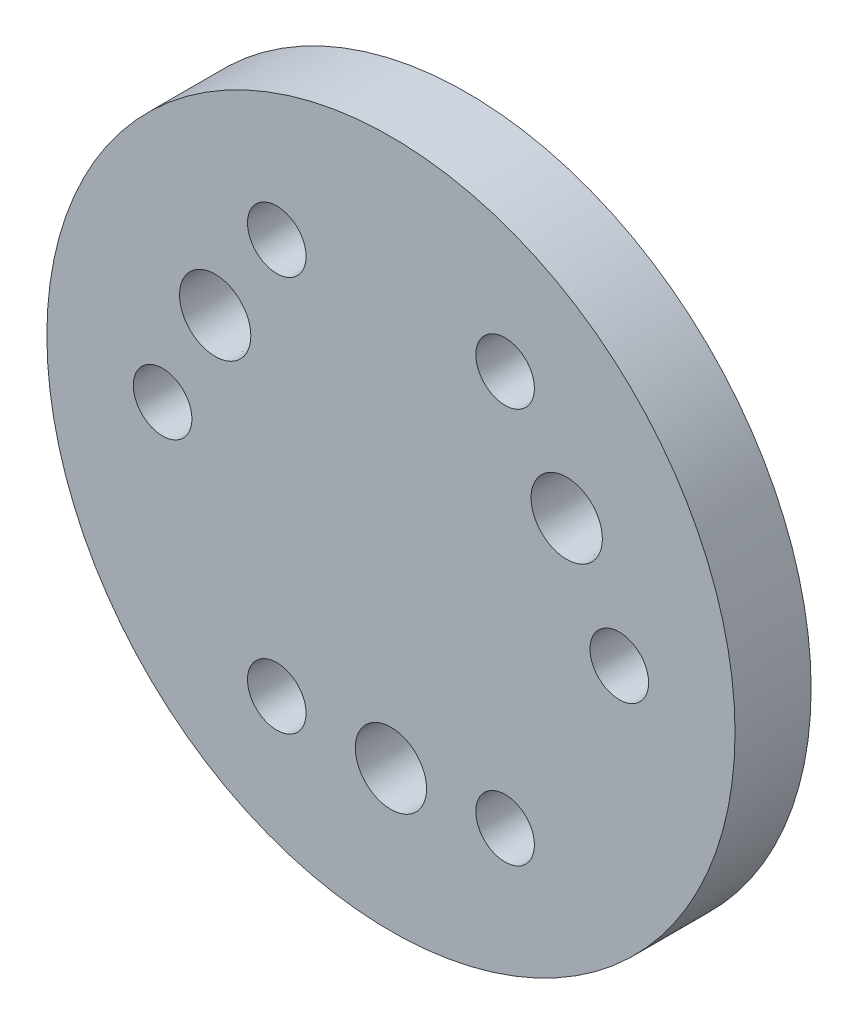
from build123d import *

# Parameters (mm, degrees)
SKETCH1_R                    = 27.125
BOSS_EXTRUDE1_DEPTH          = 6
CUT_EXTRUDE1_START           = 6
SKETCH2_R                    = 2.6
CUT_EXTRUDE1_DEPTH           = 45.826939745
CUT_EXTRUDE1_DRAFT           = 2
CUT_EXTRUDE1_PROFILE_2_DEPTH = 45.826939745
CUT_EXTRUDE1_PROFILE_2_DRAFT = 2
CUT_EXTRUDE1_PROFILE_3_DEPTH = 45.826939745
CUT_EXTRUDE1_PROFILE_3_DRAFT = 2
SKETCH2_R_2                  = 2.1
CUT_EXTRUDE1_PROFILE_4_DEPTH = 45.826939745
CUT_EXTRUDE1_PROFILE_4_DRAFT = 2
CUT_EXTRUDE1_PROFILE_5_DEPTH = 45.826939745
CUT_EXTRUDE1_PROFILE_5_DRAFT = 2
CUT_EXTRUDE1_PROFILE_6_DEPTH = 45.826939745
CUT_EXTRUDE1_PROFILE_6_DRAFT = 2
CUT_EXTRUDE1_PROFILE_7_DEPTH = 45.826939745
CUT_EXTRUDE1_PROFILE_7_DRAFT = 2
CUT_EXTRUDE1_PROFILE_8_DEPTH = 45.826939745
CUT_EXTRUDE1_PROFILE_8_DRAFT = 2
CUT_EXTRUDE1_PROFILE_9_DEPTH = 45.826939745
CUT_EXTRUDE1_PROFILE_9_DRAFT = 2


with BuildPart() as part:
    # Sketch1 → Boss-Extrude1 (new body)
    with BuildSketch(Plane(origin=(0, 0, 0), x_dir=(0, 1, 0), z_dir=(0, 0, 1))):
        with Locations(Location((0, 0, 0), (0, 0, 270))):
            Circle(SKETCH1_R)
    extrude(amount=BOSS_EXTRUDE1_DEPTH)


with BuildPart() as cut_extrude1_tool:
    # Sketch2 → Cut-Extrude1 (with draft: the straight prism first)
    with BuildSketch(Plane(origin=(0, 0, 6), x_dir=(1, 0, 0), z_dir=(0, 0, -1)).offset(CUT_EXTRUDE1_START)):
        with Locations((0, 16)):
            Circle(SKETCH2_R)
    extrude(amount=-CUT_EXTRUDE1_DEPTH)
    # Cut-Extrude1: the draft: its side faces are tilted about the plane it starts from
    cut_extrude1_sides = [cut_extrude1_tool.faces().sort_by_distance(p)[0] for p in [
        (-2.6, -16, 22.913469873),
    ]]
    draft(cut_extrude1_sides, Plane(origin=(0, 0, 6), x_dir=(1, 0, 0), z_dir=(0, 0, -1)).offset(CUT_EXTRUDE1_START), CUT_EXTRUDE1_DRAFT)


with BuildPart() as part_1:
    add(part.part)

    # Cut-Extrude1: cut by cut_extrude1_tool
    add(cut_extrude1_tool.part, mode=Mode.SUBTRACT)


with BuildPart() as cut_extrude1_profile_2_tool:
    # Sketch2 → Cut-Extrude1 profile 2 (with draft: the straight prism first)
    with BuildSketch(Plane(origin=(0, 0, 6), x_dir=(1, 0, 0), z_dir=(0, 0, -1)).offset(CUT_EXTRUDE1_START)):
        with Locations((13.856406461, -8)):
            Circle(SKETCH2_R)
    extrude(amount=-CUT_EXTRUDE1_PROFILE_2_DEPTH)
    # Cut-Extrude1 profile 2: the draft: its side faces are tilted about the plane it starts from
    cut_extrude1_profile_2_sides = [cut_extrude1_profile_2_tool.faces().sort_by_distance(p)[0] for p in [
        (11.256406461, 8, 22.913469873),
    ]]
    draft(cut_extrude1_profile_2_sides, Plane(origin=(0, 0, 6), x_dir=(1, 0, 0), z_dir=(0, 0, -1)).offset(CUT_EXTRUDE1_START), CUT_EXTRUDE1_PROFILE_2_DRAFT)


with BuildPart() as part_2:
    add(part_1.part)

    # Cut-Extrude1 profile 2: cut by cut_extrude1_profile_2_tool
    add(cut_extrude1_profile_2_tool.part, mode=Mode.SUBTRACT)


with BuildPart() as cut_extrude1_profile_3_tool:
    # Sketch2 → Cut-Extrude1 profile 3 (with draft: the straight prism first)
    with BuildSketch(Plane(origin=(0, 0, 6), x_dir=(1, 0, 0), z_dir=(0, 0, -1)).offset(CUT_EXTRUDE1_START)):
        with Locations((-13.856406461, -8)):
            Circle(SKETCH2_R)
    extrude(amount=-CUT_EXTRUDE1_PROFILE_3_DEPTH)
    # Cut-Extrude1 profile 3: the draft: its side faces are tilted about the plane it starts from
    cut_extrude1_profile_3_sides = [cut_extrude1_profile_3_tool.faces().sort_by_distance(p)[0] for p in [
        (-16.456406461, 8, 22.913469873),
    ]]
    draft(cut_extrude1_profile_3_sides, Plane(origin=(0, 0, 6), x_dir=(1, 0, 0), z_dir=(0, 0, -1)).offset(CUT_EXTRUDE1_START), CUT_EXTRUDE1_PROFILE_3_DRAFT)


with BuildPart() as part_3:
    add(part_2.part)

    # Cut-Extrude1 profile 3: cut by cut_extrude1_profile_3_tool
    add(cut_extrude1_profile_3_tool.part, mode=Mode.SUBTRACT)


with BuildPart() as cut_extrude1_profile_4_tool:
    # Sketch2 → Cut-Extrude1 profile 4 (with draft: the straight prism first)
    with BuildSketch(Plane(origin=(0, 0, 6), x_dir=(1, 0, 0), z_dir=(0, 0, -1)).offset(CUT_EXTRUDE1_START)):
        with Locations((-9, -15.588457268)):
            Circle(SKETCH2_R_2)
    extrude(amount=-CUT_EXTRUDE1_PROFILE_4_DEPTH)
    # Cut-Extrude1 profile 4: the draft: its side faces are tilted about the plane it starts from
    cut_extrude1_profile_4_sides = [cut_extrude1_profile_4_tool.faces().sort_by_distance(p)[0] for p in [
        (-11.1, 15.588457268, 22.913469873),
    ]]
    draft(cut_extrude1_profile_4_sides, Plane(origin=(0, 0, 6), x_dir=(1, 0, 0), z_dir=(0, 0, -1)).offset(CUT_EXTRUDE1_START), CUT_EXTRUDE1_PROFILE_4_DRAFT)


with BuildPart() as part_4:
    add(part_3.part)

    # Cut-Extrude1 profile 4: cut by cut_extrude1_profile_4_tool
    add(cut_extrude1_profile_4_tool.part, mode=Mode.SUBTRACT)


with BuildPart() as cut_extrude1_profile_5_tool:
    # Sketch2 → Cut-Extrude1 profile 5 (with draft: the straight prism first)
    with BuildSketch(Plane(origin=(0, 0, 6), x_dir=(1, 0, 0), z_dir=(0, 0, -1)).offset(CUT_EXTRUDE1_START)):
        with Locations((-18, 0)):
            Circle(SKETCH2_R_2)
    extrude(amount=-CUT_EXTRUDE1_PROFILE_5_DEPTH)
    # Cut-Extrude1 profile 5: the draft: its side faces are tilted about the plane it starts from
    cut_extrude1_profile_5_sides = [cut_extrude1_profile_5_tool.faces().sort_by_distance(p)[0] for p in [
        (-20.1, 0, 22.913469873),
    ]]
    draft(cut_extrude1_profile_5_sides, Plane(origin=(0, 0, 6), x_dir=(1, 0, 0), z_dir=(0, 0, -1)).offset(CUT_EXTRUDE1_START), CUT_EXTRUDE1_PROFILE_5_DRAFT)


with BuildPart() as part_5:
    add(part_4.part)

    # Cut-Extrude1 profile 5: cut by cut_extrude1_profile_5_tool
    add(cut_extrude1_profile_5_tool.part, mode=Mode.SUBTRACT)


with BuildPart() as cut_extrude1_profile_6_tool:
    # Sketch2 → Cut-Extrude1 profile 6 (with draft: the straight prism first)
    with BuildSketch(Plane(origin=(0, 0, 6), x_dir=(1, 0, 0), z_dir=(0, 0, -1)).offset(CUT_EXTRUDE1_START)):
        with Locations((-9, 15.588457268)):
            Circle(SKETCH2_R_2)
    extrude(amount=-CUT_EXTRUDE1_PROFILE_6_DEPTH)
    # Cut-Extrude1 profile 6: the draft: its side faces are tilted about the plane it starts from
    cut_extrude1_profile_6_sides = [cut_extrude1_profile_6_tool.faces().sort_by_distance(p)[0] for p in [
        (-11.1, -15.588457268, 22.913469873),
    ]]
    draft(cut_extrude1_profile_6_sides, Plane(origin=(0, 0, 6), x_dir=(1, 0, 0), z_dir=(0, 0, -1)).offset(CUT_EXTRUDE1_START), CUT_EXTRUDE1_PROFILE_6_DRAFT)


with BuildPart() as part_6:
    add(part_5.part)

    # Cut-Extrude1 profile 6: cut by cut_extrude1_profile_6_tool
    add(cut_extrude1_profile_6_tool.part, mode=Mode.SUBTRACT)


with BuildPart() as cut_extrude1_profile_7_tool:
    # Sketch2 → Cut-Extrude1 profile 7 (with draft: the straight prism first)
    with BuildSketch(Plane(origin=(0, 0, 6), x_dir=(1, 0, 0), z_dir=(0, 0, -1)).offset(CUT_EXTRUDE1_START)):
        with Locations((9, 15.588457268)):
            Circle(SKETCH2_R_2)
    extrude(amount=-CUT_EXTRUDE1_PROFILE_7_DEPTH)
    # Cut-Extrude1 profile 7: the draft: its side faces are tilted about the plane it starts from
    cut_extrude1_profile_7_sides = [cut_extrude1_profile_7_tool.faces().sort_by_distance(p)[0] for p in [
        (6.9, -15.588457268, 22.913469873),
    ]]
    draft(cut_extrude1_profile_7_sides, Plane(origin=(0, 0, 6), x_dir=(1, 0, 0), z_dir=(0, 0, -1)).offset(CUT_EXTRUDE1_START), CUT_EXTRUDE1_PROFILE_7_DRAFT)


with BuildPart() as part_7:
    add(part_6.part)

    # Cut-Extrude1 profile 7: cut by cut_extrude1_profile_7_tool
    add(cut_extrude1_profile_7_tool.part, mode=Mode.SUBTRACT)


with BuildPart() as cut_extrude1_profile_8_tool:
    # Sketch2 → Cut-Extrude1 profile 8 (with draft: the straight prism first)
    with BuildSketch(Plane(origin=(0, 0, 6), x_dir=(1, 0, 0), z_dir=(0, 0, -1)).offset(CUT_EXTRUDE1_START)):
        with Locations((18, 0)):
            Circle(SKETCH2_R_2)
    extrude(amount=-CUT_EXTRUDE1_PROFILE_8_DEPTH)
    # Cut-Extrude1 profile 8: the draft: its side faces are tilted about the plane it starts from
    cut_extrude1_profile_8_sides = [cut_extrude1_profile_8_tool.faces().sort_by_distance(p)[0] for p in [
        (15.9, 0, 22.913469873),
    ]]
    draft(cut_extrude1_profile_8_sides, Plane(origin=(0, 0, 6), x_dir=(1, 0, 0), z_dir=(0, 0, -1)).offset(CUT_EXTRUDE1_START), CUT_EXTRUDE1_PROFILE_8_DRAFT)


with BuildPart() as part_8:
    add(part_7.part)

    # Cut-Extrude1 profile 8: cut by cut_extrude1_profile_8_tool
    add(cut_extrude1_profile_8_tool.part, mode=Mode.SUBTRACT)


with BuildPart() as cut_extrude1_profile_9_tool:
    # Sketch2 → Cut-Extrude1 profile 9 (with draft: the straight prism first)
    with BuildSketch(Plane(origin=(0, 0, 6), x_dir=(1, 0, 0), z_dir=(0, 0, -1)).offset(CUT_EXTRUDE1_START)):
        with Locations((9, -15.588457268)):
            Circle(SKETCH2_R_2)
    extrude(amount=-CUT_EXTRUDE1_PROFILE_9_DEPTH)
    # Cut-Extrude1 profile 9: the draft: its side faces are tilted about the plane it starts from
    cut_extrude1_profile_9_sides = [cut_extrude1_profile_9_tool.faces().sort_by_distance(p)[0] for p in [
        (6.9, 15.588457268, 22.913469873),
    ]]
    draft(cut_extrude1_profile_9_sides, Plane(origin=(0, 0, 6), x_dir=(1, 0, 0), z_dir=(0, 0, -1)).offset(CUT_EXTRUDE1_START), CUT_EXTRUDE1_PROFILE_9_DRAFT)


with BuildPart() as part_9:
    add(part_8.part)

    # Cut-Extrude1 profile 9: cut by cut_extrude1_profile_9_tool
    add(cut_extrude1_profile_9_tool.part, mode=Mode.SUBTRACT)


solid = part_9.part
